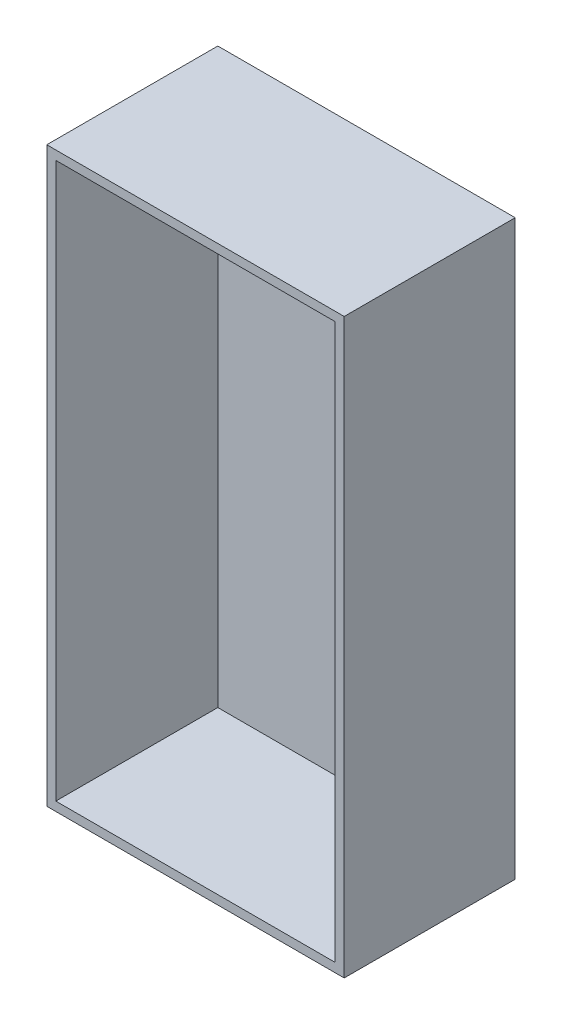
from build123d import *

# Parameters (mm, degrees)
BOSS_EXTRUDE1_DEPTH = 45.72
SHELL1_T            = 2.54


with BuildPart() as part:
    # Sketch7 → Boss-Extrude1 (new body)
    with BuildSketch(Plane.XY):
        Polygon((9.655091904, 152.134877954), (82.143686264, 152.134877954), (82.143686264, -4.447468667), (14.497027414, -4.447468667), (3.305091904, -4.447468667), (3.305091904, 92.914044904), (3.305091904, 152.134877954), align=None)
    extrude(amount=BOSS_EXTRUDE1_DEPTH)

    # Shell1
    shell1_openings = [part.faces().sort_by_distance(p)[0] for p in [
        (42.724389084, 73.843704643, 45.72),
    ]]
    offset(amount=SHELL1_T, openings=shell1_openings, kind=Kind.INTERSECTION)


solid = part.part
